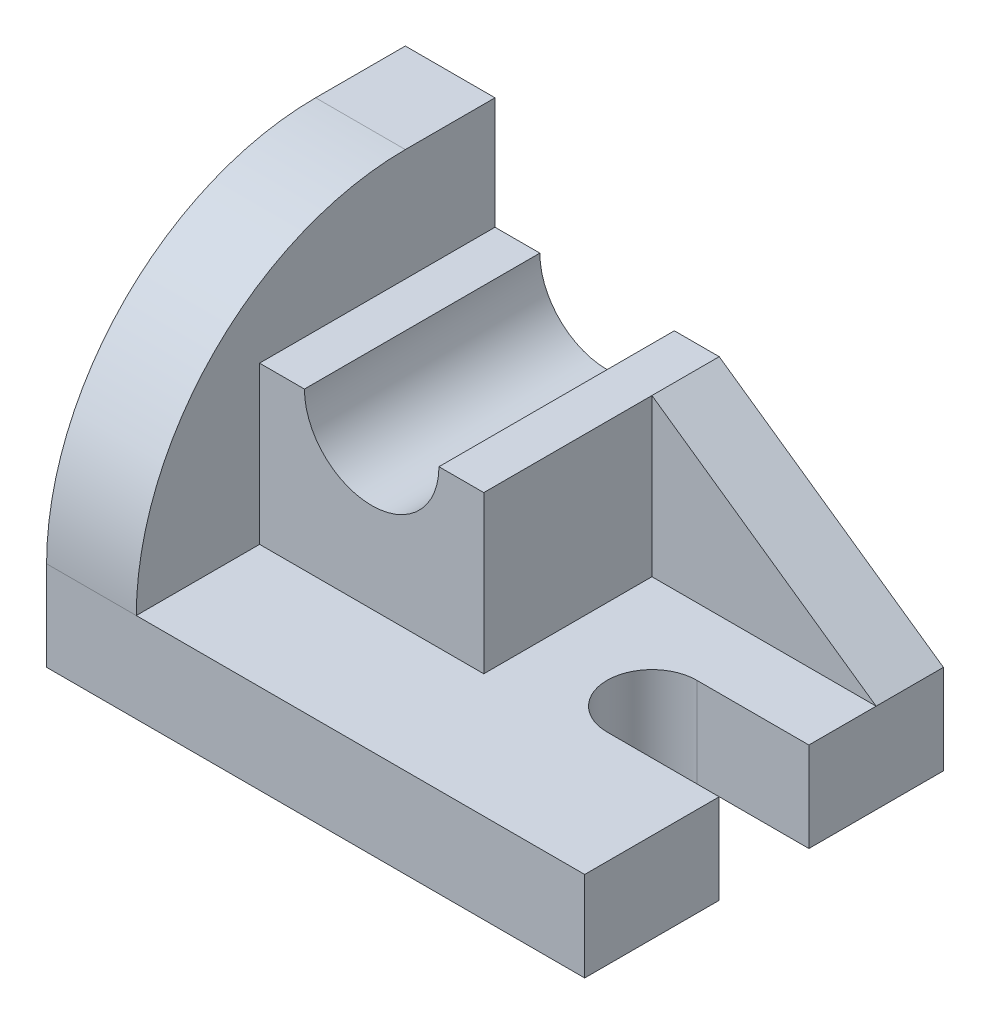
from build123d import *

# Parameters (mm, degrees)
BOSS_EXTRUDE6_DEPTH = 16
SKETCH2_W           = 16
SKETCH2_H           = 48
BOSS_EXTRUDE7_DEPTH = 64
FILLET2_R           = 48
SKETCH3_W           = 42
SKETCH3_H           = 28
BOSS_EXTRUDE8_DEPTH = 40
SKETCH4_R           = 12
CUT_EXTRUDE2_DEPTH  = 69
BOSS_EXTRUDE9_DEPTH = 12


with BuildPart() as part:
    # Sketch1 → Boss-Extrude6 (new body)
    with BuildSketch(Plane(origin=(0, 0, 0), x_dir=(1, 0, 0), z_dir=(0, 1, 0))):
        with BuildLine():
            Line((48, 32), (-48, 32))
            Line((-48, 32), (-48, -32))
            Line((-48, -32), (48, -32))
            Line((48, -32), (48, -8))
            Line((48, -8), (28, -8))
            ThreePointArc((28, -8), (20, 0), (28, 8))
            Line((28, 8), (48, 8))
            Line((48, 8), (48, 32))
        make_face()
    extrude(amount=BOSS_EXTRUDE6_DEPTH)

    # Sketch2 → Boss-Extrude7 (add)
    with BuildSketch(Plane.XY.offset(32)):
        with Locations((-40, 40)):
            Rectangle(SKETCH2_W, SKETCH2_H)
    extrude(amount=-BOSS_EXTRUDE7_DEPTH)

    # Fillet2
    fillet2_edges = [part.edges().sort_by_distance(p)[0] for p in [
        (-40, 64, 32),
    ]]
    fillet(fillet2_edges, radius=FILLET2_R)

    # Sketch3 → Boss-Extrude8 (add)
    with BuildSketch(Plane(origin=(-32, 0, 0), x_dir=(0, 0, -1), z_dir=(1, 0, 0))):
        with Locations((11, 30)):
            Rectangle(SKETCH3_W, SKETCH3_H)
    extrude(amount=BOSS_EXTRUDE8_DEPTH)

    # Sketch4 → Cut-Extrude2 (cut)
    with BuildSketch(Plane.XY.offset(10)):
        with Locations((-12, 44)):
            Circle(SKETCH4_R)
    extrude(amount=-CUT_EXTRUDE2_DEPTH, mode=Mode.SUBTRACT)

    # Sketch5 → Boss-Extrude9 (add)
    with BuildSketch(Plane(origin=(0, 0, -32), x_dir=(-1, 0, 0), z_dir=(0, 0, -1))):
        Polygon((-8, 44), (-48, 16), (-8, 16), align=None)
    extrude(amount=-BOSS_EXTRUDE9_DEPTH)


solid = part.part
